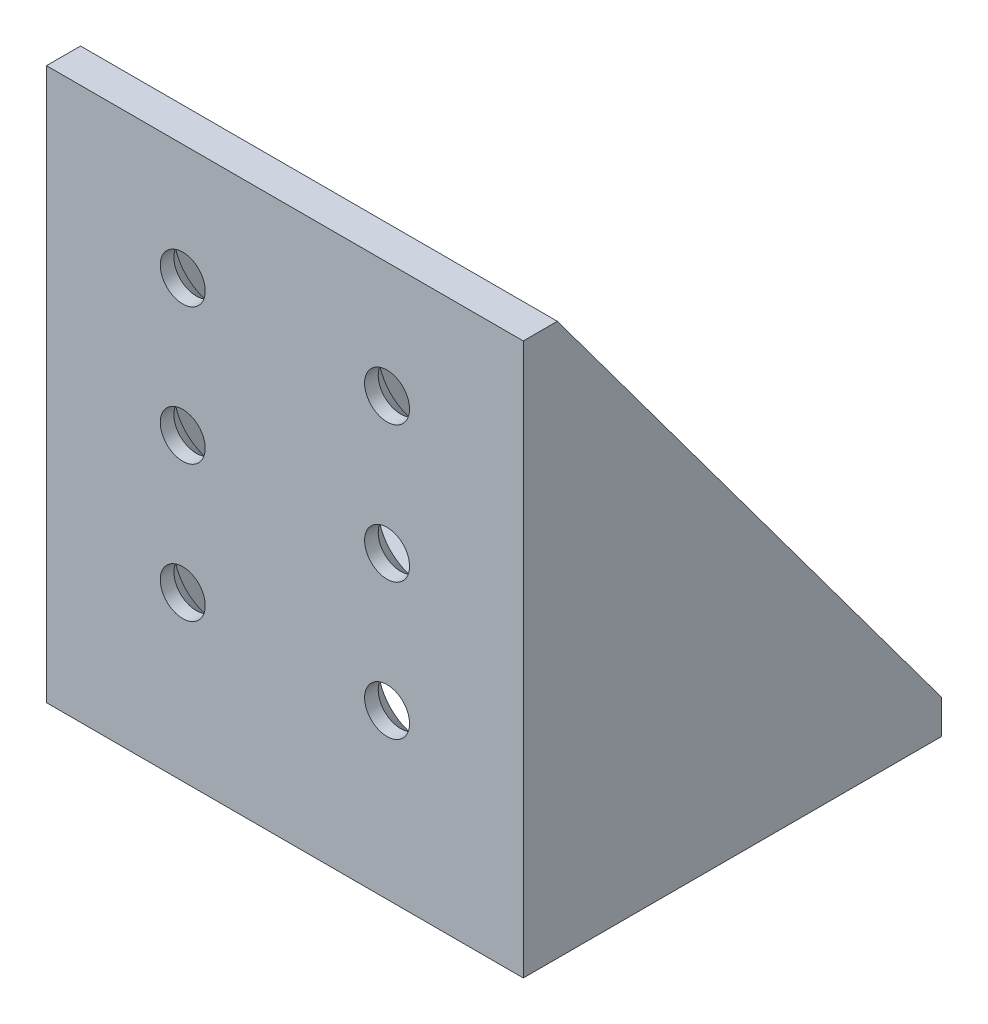
from build123d import *

# Parameters (mm, degrees)
DODANIE_WYCI_GNI_CIE1_DEPTH              = 70
DODANIE_WYCI_GNI_CIE2_DEPTH              = 6.8
OTW_R_GWINTOWANY_M41_D                   = 3.3
SZKIC3_R                                 = 19.05
WYTNIJ_WYCI_GNI_CIE1_DEPTH               = 9.8
POG_BIENIE_STO_KOWE_POD_M6_RUB_Z_2_COUNT = 2
POG_BIENIE_STO_KOWE_POD_M6_RUB_Z_2_PITCH = 30
POG_BIENIE_STO_KOWE_POD_M6_RUB_Z_3_COUNT = 2
POG_BIENIE_STO_KOWE_POD_M6_RUB_Z_3_PITCH = 20
POG_BIENIE_STO_KOWE_POD_M6_RUB_Z_4_COUNT = 2
POG_BIENIE_STO_KOWE_POD_M6_RUB_Z_4_PITCH = 36.055512755
POG_BIENIE_STO_KOWE_POD_M6_RUB_Z_5_COUNT = 2
POG_BIENIE_STO_KOWE_POD_M6_RUB_Z_5_PITCH = 40
POG_BIENIE_STO_KOWE_POD_M6_RUB_Z_6_COUNT = 2
POG_BIENIE_STO_KOWE_POD_M6_RUB_Z_6_PITCH = 50


with BuildPart() as part:
    # Szkic1 → Dodanie-wyciągnięcie1 (new body)
    with BuildSketch(Plane(origin=(0, 0, 0), x_dir=(0, 0, -1), z_dir=(1, 0, 0))):
        Polygon((0, 0), (61.4, 0), (61.4, 5), (5, 5), (5, 81), (0, 81), align=None)
    extrude(amount=DODANIE_WYCI_GNI_CIE1_DEPTH)

    # Szkic2 → Dodanie-wyciągnięcie2 (add)
    with BuildSketch(Plane(origin=(70, 0, 0), x_dir=(0, 0, -1), z_dir=(1, 0, 0))):
        Polygon((5, 81), (61.4, 5), (5, 5), align=None)
    dodanie_wyci_gni_cie2 = extrude(amount=-DODANIE_WYCI_GNI_CIE2_DEPTH)

    # Lustro1: Dodanie-wyciągnięcie2 across plane
    add(dodanie_wyci_gni_cie2.mirror(Plane(origin=(35, 0, 0), x_dir=(0, 0, 1), z_dir=(1, 0, 0))))

    # Otwór gwintowany M41 (through all)
    with Locations(Plane(origin=(11.455, 5, -57.137511403), x_dir=(0, 0, 1), z_dir=(0, 1, 0))):
        with Locations((0, 0), (0, 47.09), (47.09, 0), (47.09, 47.09)):
            Hole(OTW_R_GWINTOWANY_M41_D / 2)

    # Szkic3 → Wytnij-wyciągnięcie1 (cut)
    with BuildSketch(Plane(origin=(0, 5, 0), x_dir=(1, 0, 0), z_dir=(0, 1, 0))):
        with Locations(Location((35, 33.2, 0), (0, 0, 270))):
            Circle(SZKIC3_R)
    extrude(amount=-WYTNIJ_WYCI_GNI_CIE1_DEPTH, mode=Mode.SUBTRACT)

    # Szkic7 → Pogłębienie stożkowe pod M6 Śrubę z łbem soczewkowym1 (revolve, cut)
    with BuildSketch(Plane(origin=(50, 64, -5), x_dir=(0, 1, 0), z_dir=(1, 0, 0))):
        Polygon((0, 0), (0, 5), (3.3, 5), (3.3, 3), (6.3, 0), align=None)
    pog_bienie_sto_kowe_pod_m6_rub_z_bem = revolve(axis=Axis((50, 64, -11.35), (0, 0, 1)), mode=Mode.SUBTRACT)

    # Pog_bienie sto_kowe pod M6 _rub_ z _ 2: Pogłębienie stożkowe pod M6 Śrubę z łbem soczewkowym1 ×2
    with Locations(*[(-i * POG_BIENIE_STO_KOWE_POD_M6_RUB_Z_2_PITCH, 0, 0) for i in range(1, POG_BIENIE_STO_KOWE_POD_M6_RUB_Z_2_COUNT)]):
        add(pog_bienie_sto_kowe_pod_m6_rub_z_bem, mode=Mode.SUBTRACT)

    # Pog_bienie sto_kowe pod M6 _rub_ z _ 3: Pogłębienie stożkowe pod M6 Śrubę z łbem soczewkowym1 ×2
    with Locations(*[(0, -i * POG_BIENIE_STO_KOWE_POD_M6_RUB_Z_3_PITCH, 0) for i in range(1, POG_BIENIE_STO_KOWE_POD_M6_RUB_Z_3_COUNT)]):
        add(pog_bienie_sto_kowe_pod_m6_rub_z_bem, mode=Mode.SUBTRACT)

    # Pog_bienie sto_kowe pod M6 _rub_ z _ 4: Pogłębienie stożkowe pod M6 Śrubę z łbem soczewkowym1 ×2
    with Locations(*[Vector(-0.8320502943378438, -0.5547001962252289, 0) * (i * POG_BIENIE_STO_KOWE_POD_M6_RUB_Z_4_PITCH) for i in range(1, POG_BIENIE_STO_KOWE_POD_M6_RUB_Z_4_COUNT)]):
        add(pog_bienie_sto_kowe_pod_m6_rub_z_bem, mode=Mode.SUBTRACT)

    # Pog_bienie sto_kowe pod M6 _rub_ z _ 5: Pogłębienie stożkowe pod M6 Śrubę z łbem soczewkowym1 ×2
    with Locations(*[(0, -i * POG_BIENIE_STO_KOWE_POD_M6_RUB_Z_5_PITCH, 0) for i in range(1, POG_BIENIE_STO_KOWE_POD_M6_RUB_Z_5_COUNT)]):
        add(pog_bienie_sto_kowe_pod_m6_rub_z_bem, mode=Mode.SUBTRACT)

    # Pog_bienie sto_kowe pod M6 _rub_ z _ 6: Pogłębienie stożkowe pod M6 Śrubę z łbem soczewkowym1 ×2
    with Locations(*[Vector(-0.6000000000000001, -0.7999999999999999, 0) * (i * POG_BIENIE_STO_KOWE_POD_M6_RUB_Z_6_PITCH) for i in range(1, POG_BIENIE_STO_KOWE_POD_M6_RUB_Z_6_COUNT)]):
        add(pog_bienie_sto_kowe_pod_m6_rub_z_bem, mode=Mode.SUBTRACT)


solid = part.part
